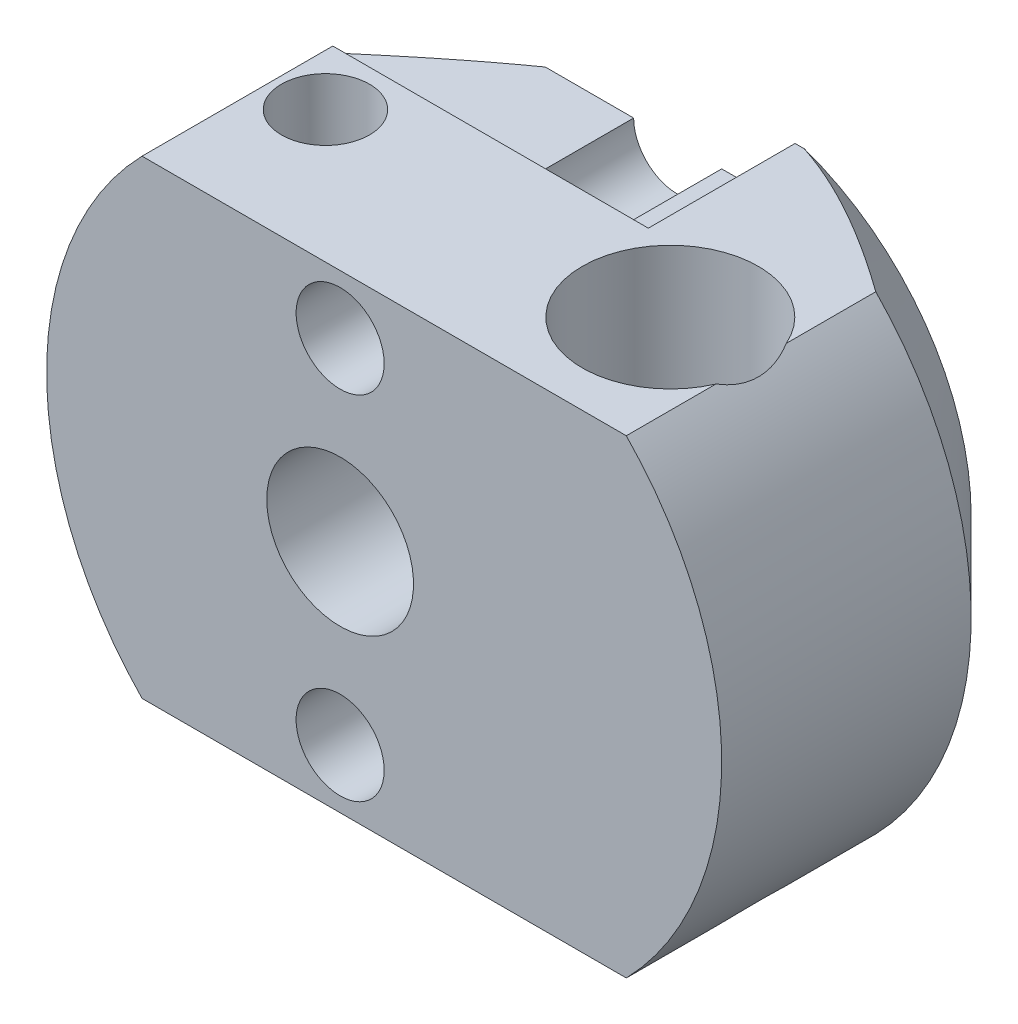
from build123d import *

# Parameters (mm, degrees)
EXTRUDE_1_DEPTH              = 11.5
CUT_EXTRUDE_1_DEPTH          = 5
CUT_EXTRUDE_2_DEPTH          = 5
HOLE_WIZARD_3_0_3_1_D        = 3
HOLE_WIZARD_3_0_3_2_D        = 3
HOLE_WIZARD_2_5_2_5_1_REACH  = 21.112
HOLE_WIZARD_2_5_2_5_1_BORE_R = 1.25
HOLE_WIZARD_5_0_5_1_D        = 5
HOLE_WIZARD_6_0_6_1_D        = 6
HOLE_WIZARD_2_5_2_5_2_REACH  = 21.112
HOLE_WIZARD_2_5_2_5_2_BORE_R = 1.25
CHAMFER_1_SIZE               = 3


with BuildPart() as part:
    # Эскиз1 → Бобышка-Вытянуть1 (new body)
    with BuildSketch(Plane(origin=(0, 0, 0), x_dir=(-1, 0, 0), z_dir=(0, 0, -1))):
        with BuildLine():
            Line((6.75, 8), (-9.75, 8))
            ThreePointArc((-9.75, 8), (-13, 0), (-9.75, -8))
            Line((-9.75, -8), (6.75, -8))
            ThreePointArc((6.75, -8), (10, 0), (6.75, 8))
        make_face()
    extrude(amount=-EXTRUDE_1_DEPTH)

    # Эскиз2 → Вырез-Вытянуть1 (cut)
    with BuildSketch(Plane(origin=(0, 0, 0), x_dir=(-1, 0, 0), z_dir=(0, 0, -1))):
        with BuildLine():
            Line((-4, 6), (8.305725542, 6))
            ThreePointArc((8.305725542, 6), (7.583253924, 7.043086716), (6.75, 8))
            Line((6.75, 8), (-4, 8))
            Line((-4, 8), (-4, 6))
        make_face()
    extrude(amount=-CUT_EXTRUDE_1_DEPTH, mode=Mode.SUBTRACT)

    # Эскиз3 → Вырез-Вытянуть2 (cut)
    with BuildSketch(Plane(origin=(0, 0, 0), x_dir=(-1, 0, 0), z_dir=(0, 0, -1))):
        with BuildLine():
            Line((8.305725542, -6), (-4, -6))
            Line((-4, -6), (-4, -8))
            Line((-4, -8), (6.75, -8))
            ThreePointArc((6.75, -8), (7.583253924, -7.043086716), (8.305725542, -6))
        make_face()
    extrude(amount=-CUT_EXTRUDE_2_DEPTH, mode=Mode.SUBTRACT)

    # Диаметр отверстия Ø3.0 (3)1 (through all)
    with Locations(Plane.XY.offset(11.5)):
        with Locations((0, -6), (0, 6)):
            Hole(HOLE_WIZARD_3_0_3_1_D / 2)

    # Диаметр отверстия Ø3.0 (3)2 (through all)
    with Locations(Plane(origin=(0, 8, 0), x_dir=(1, 0, 0), z_dir=(0, 1, 0))):
        with Locations((-5, -7)):
            Hole(HOLE_WIZARD_3_0_3_2_D / 2)

    # Диаметр отверстия Ø2.5 (2.5)1 bore → Диаметр отверстия Ø2.5 (2.5)1 (cut, up to next)
    with BuildSketch(Plane(origin=(0, 0, 0), x_dir=(-1, 0, 0), z_dir=(0, 0, -1)), mode=Mode.PRIVATE) as hole_wizard_2_5_2_5_1_sk1:
        with Locations((5, 0)):
            Circle(HOLE_WIZARD_2_5_2_5_1_BORE_R)
    hole_wizard_2_5_2_5_1_tool1 = extrude(hole_wizard_2_5_2_5_1_sk1.sketch, amount=-HOLE_WIZARD_2_5_2_5_1_REACH, mode=Mode.PRIVATE) & part.part
    add(hole_wizard_2_5_2_5_1_tool1.solids().sort_by_distance((-5, 0, 0))[0], mode=Mode.SUBTRACT)

    # Диаметр отверстия Ø5.0 (5)1 (through all)
    with Locations(Plane(origin=(0, 0, 0), x_dir=(-1, 0, 0), z_dir=(0, 0, -1))):
        with Locations((0, 0)):
            Hole(HOLE_WIZARD_5_0_5_1_D / 2)

    # Диаметр отверстия Ø6.0 (6)1 (through all)
    with Locations(Plane(origin=(0, -8, 0), x_dir=(-1, 0, 0), z_dir=(0, -1, 0))):
        with Locations((-7, -7.25)):
            Hole(HOLE_WIZARD_6_0_6_1_D / 2)

    # Диаметр отверстия Ø2.5 (2.5)2 bore → Диаметр отверстия Ø2.5 (2.5)2 (cut, up to next)
    with BuildSketch(Plane(origin=(0, 0, 0), x_dir=(-1, 0, 0), z_dir=(0, 0, -1)), mode=Mode.PRIVATE) as hole_wizard_2_5_2_5_2_sk1:
        with Locations((-7, 0)):
            Circle(HOLE_WIZARD_2_5_2_5_2_BORE_R)
    hole_wizard_2_5_2_5_2_tool1 = extrude(hole_wizard_2_5_2_5_2_sk1.sketch, amount=-HOLE_WIZARD_2_5_2_5_2_REACH, mode=Mode.PRIVATE) & part.part
    add(hole_wizard_2_5_2_5_2_tool1.solids().sort_by_distance((7, 0, 0))[0], mode=Mode.SUBTRACT)

    # Фаска1
    chamfer_1_edges = [part.edges().sort_by_distance(p)[0] for p in [
        (-10, 0, 0),
        (13, 0, 0),
    ]]
    chamfer(chamfer_1_edges, length=CHAMFER_1_SIZE)


solid = part.part
